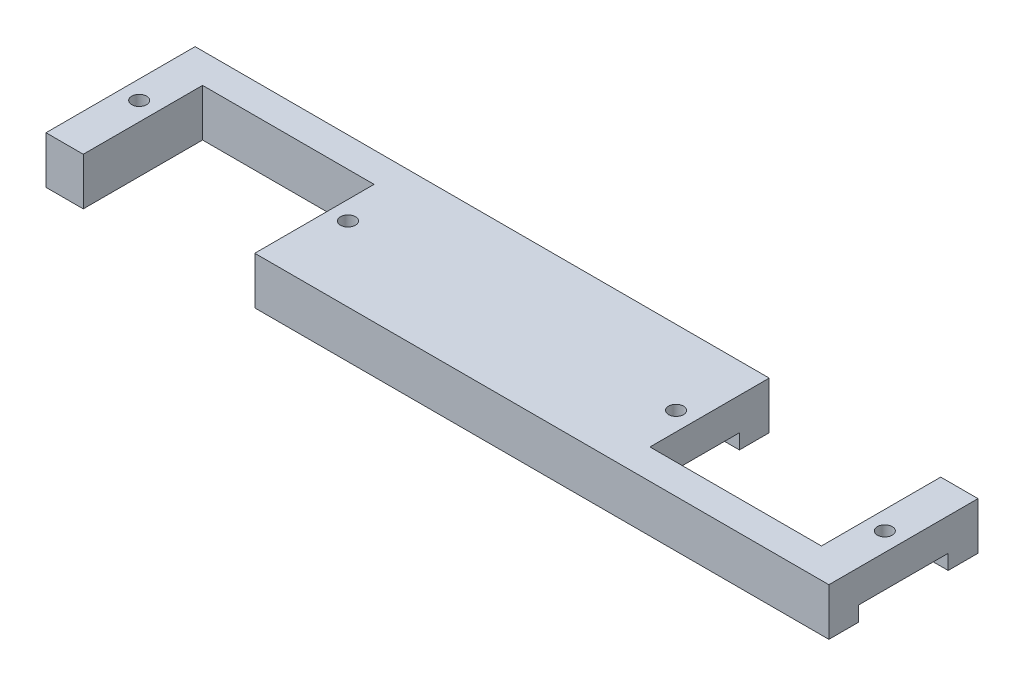
from build123d import *

# Parameters (mm, degrees)
SKETCH1_W            = 105
SKETCH1_H            = 20
BOSS_EXTRUDE1_DEPTH  = 6.35
SKETCH3_W            = 23
SKETCH3_H            = 16
CUT_EXTRUDE1_DEPTH   = 54.819815124
SKETCH4_W            = 5
SKETCH4_H            = 12
CUT_EXTRUDE2_DEPTH   = 2
M2_CLEARANCE_HOLE1_D = 2


with BuildPart() as part:
    # Sketch1 → Boss-Extrude1 (new body)
    with BuildSketch(Plane(origin=(0, 0, 0), x_dir=(1, 0, 0), z_dir=(0, 1, 0))):
        Rectangle(SKETCH1_W, SKETCH1_H)
    extrude(amount=BOSS_EXTRUDE1_DEPTH)

    # Sketch3 → Cut-Extrude1 (cut, through all)
    with BuildSketch(Plane(origin=(0, 6.35, 0), x_dir=(1, 0, 0), z_dir=(0, 1, 0))):
        with Locations((-36, -2)):
            Rectangle(SKETCH3_W, SKETCH3_H)
        with Locations((36, 2)):
            Rectangle(SKETCH3_W, SKETCH3_H)
    extrude(amount=-CUT_EXTRUDE1_DEPTH, mode=Mode.SUBTRACT)

    # Sketch4 → Cut-Extrude2 (cut)
    with BuildSketch(Plane.XZ):
        with Locations((22, 0)):
            Rectangle(SKETCH4_W, SKETCH4_H)
        with Locations((50, 0)):
            Rectangle(SKETCH4_W, SKETCH4_H)
    extrude(amount=-CUT_EXTRUDE2_DEPTH, mode=Mode.SUBTRACT)

    # M2 Clearance Hole1 (through all)
    with Locations(Plane(origin=(0, 6.35, 0), x_dir=(1, 0, 0), z_dir=(0, 1, 0))):
        with Locations((50, 0), (-50, 0), (-22, 0), (22, 0)):
            Hole(M2_CLEARANCE_HOLE1_D / 2)


solid = part.part
